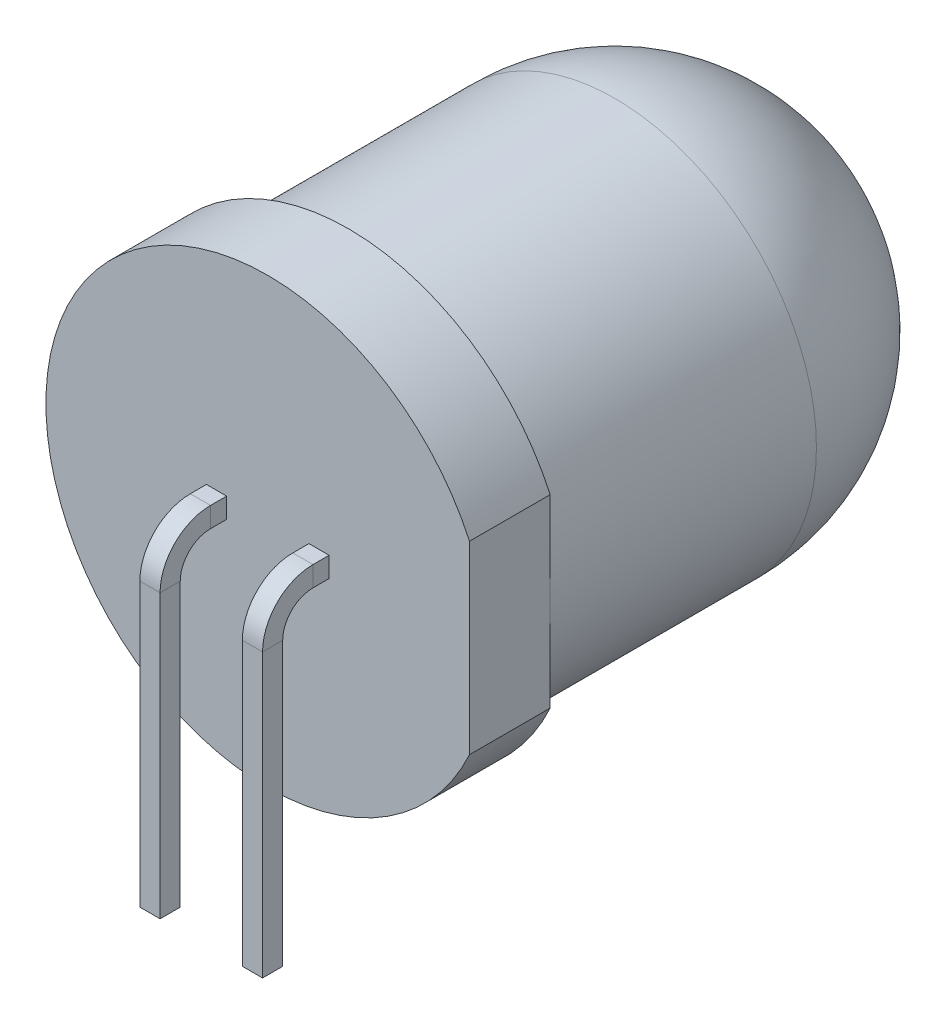
from build123d import *

# Parameters (mm, degrees)
SKETCH2_W          = 0.5
SKETCH2_H          = 4.582575694
CUT_EXTRUDE1_DEPTH = 16.667163113
SKETCH3_W          = 0.5
SKETCH3_H          = 0.5


with BuildPart() as part:
    # Sketch1 → Revolve1 (revolve)
    with BuildSketch(Plane(origin=(0, 0, 0), x_dir=(1, 0, 0), z_dir=(0, 1, 0))):
        with BuildLine():
            Line((0, 0), (0, 13.6))
            ThreePointArc((0, 13.6), (3.535533906, 12.135533906), (5, 8.6))
            Line((5, 8.6), (5, 2))
            Line((5, 2), (5.5, 2))
            Line((5.5, 2), (5.5, 0))
            Line((5.5, 0), (0, 0))
        make_face()
    revolve(axis=Axis((0, 0, 0), (0, 0, -1)))

    # Sketch2 → Cut-Extrude1 (cut, through all)
    with BuildSketch(Plane.XY):
        with Locations((5.25, 0)):
            Rectangle(SKETCH2_W, SKETCH2_H)
    extrude(amount=-CUT_EXTRUDE1_DEPTH, mode=Mode.SUBTRACT)

    # Sweep1: sweep along a path in Sketch4
    with BuildLine(Plane(origin=(1.27, 0, 0), x_dir=(0, 0, -1), z_dir=(1, 0, 0))) as sweep1_path:
        Line((0, 0), (-0.4, 0))
        ThreePointArc((-0.4, 0), (-1.107106781, -0.292893219), (-1.4, -1))
        Line((-1.4, -1), (-1.4, -8))
    # Sketch3 → Sweep1 (sweep)
    with BuildSketch(Plane.XY):
        with Locations((-1.27, 0)):
            Rectangle(SKETCH3_W, SKETCH3_H)
        with Locations((1.27, 0)):
            Rectangle(SKETCH3_W, SKETCH3_H)
    sweep(path=sweep1_path.line)


solid = part.part
